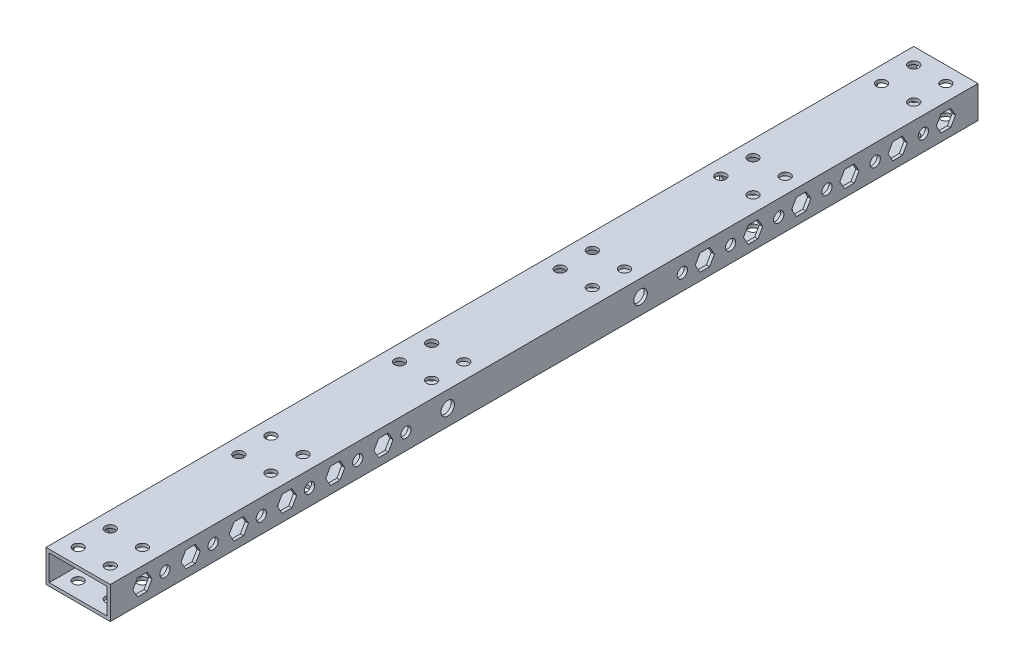
from build123d import *

# Parameters (mm, degrees)
SKETCH_1_W          = 20
SKETCH_1_H          = 10
SKETCH_1_W_2        = 18
SKETCH_1_H_2        = 8
EXTRUDE_1_DEPTH     = 270
SKETCH_2_R          = 1.575
CUT_EXTRUDE_1_DEPTH = 271.924343683
SKETCH_3_R          = 2.1
SKETCH_3_R_2        = 1.6
CUT_EXTRUDE_2_DEPTH = 271.924343683


with BuildPart() as part:
    # 草图1 → 拉伸-薄壁1 (new body)
    with BuildSketch(Plane.XY):
        with Locations((10, -5)):
            Rectangle(SKETCH_1_W, SKETCH_1_H)
        with Locations((10, -5)):
            Rectangle(SKETCH_1_W_2, SKETCH_1_H_2, mode=Mode.SUBTRACT)
    extrude(amount=EXTRUDE_1_DEPTH)

    # 草图2 → 切除-拉伸1 (cut, through all)
    with BuildSketch(Plane(origin=(0, 0, 0), x_dir=(1, 0, 0), z_dir=(0, 1, 0))):
        with Locations(Location((5, -5, 0), (0, 0, 270))):
            Circle(SKETCH_2_R)
        with Locations(Location((15, -5, 0), (0, 0, 90))):
            Circle(SKETCH_2_R)
        with Locations(Location((15, -15, 0), (0, 0, 270))):
            Circle(SKETCH_2_R)
        with Locations(Location((5, -15, 0), (0, 0, 90))):
            Circle(SKETCH_2_R)
        with Locations(Location((5, -255, 0), (0, 0, 270))):
            Circle(SKETCH_2_R)
        with Locations(Location((15, -255, 0), (0, 0, 90))):
            Circle(SKETCH_2_R)
        with Locations(Location((15, -265, 0), (0, 0, 270))):
            Circle(SKETCH_2_R)
        with Locations(Location((5, -265, 0), (0, 0, 90))):
            Circle(SKETCH_2_R)
        with Locations(Location((5, -55, 0), (0, 0, 270))):
            Circle(SKETCH_2_R)
        with Locations(Location((15, -55, 0), (0, 0, 90))):
            Circle(SKETCH_2_R)
        with Locations(Location((5, -65, 0), (0, 0, 90))):
            Circle(SKETCH_2_R)
        with Locations(Location((15, -65, 0), (0, 0, 270))):
            Circle(SKETCH_2_R)
        with Locations(Location((5, -105, 0), (0, 0, 270))):
            Circle(SKETCH_2_R)
        with Locations(Location((15, -105, 0), (0, 0, 90))):
            Circle(SKETCH_2_R)
        with Locations(Location((5, -115, 0), (0, 0, 90))):
            Circle(SKETCH_2_R)
        with Locations(Location((15, -115, 0), (0, 0, 270))):
            Circle(SKETCH_2_R)
        with Locations(Location((15, -155, 0), (0, 0, 90))):
            Circle(SKETCH_2_R)
        with Locations(Location((5, -155, 0), (0, 0, 270))):
            Circle(SKETCH_2_R)
        with Locations(Location((15, -165, 0), (0, 0, 270))):
            Circle(SKETCH_2_R)
        with Locations(Location((5, -165, 0), (0, 0, 90))):
            Circle(SKETCH_2_R)
        with Locations(Location((15, -205, 0), (0, 0, 90))):
            Circle(SKETCH_2_R)
        with Locations(Location((5, -205, 0), (0, 0, 270))):
            Circle(SKETCH_2_R)
        with Locations(Location((15, -215, 0), (0, 0, 270))):
            Circle(SKETCH_2_R)
        with Locations(Location((5, -215, 0), (0, 0, 90))):
            Circle(SKETCH_2_R)
    extrude(amount=-CUT_EXTRUDE_1_DEPTH, mode=Mode.SUBTRACT)

    # 草图3 → 切除-拉伸2 (cut, through all)
    with BuildSketch(Plane.ZY):
        with Locations((105, -5)):
            Circle(SKETCH_3_R)
        with Locations(Location((165, -5, 0), (0, 0, 270))):
            Circle(SKETCH_3_R)
        with Locations(Location((17, -5, 0), (0, 0, 270))):
            Circle(SKETCH_3_R_2)
        with Locations(Location((32, -5, 0), (0, 0, 270))):
            Circle(SKETCH_3_R_2)
        with Locations(Location((47, -5, 0), (0, 0, 270))):
            Circle(SKETCH_3_R_2)
        with Locations(Location((62, -5, 0), (0, 0, 270))):
            Circle(SKETCH_3_R_2)
        with Locations(Location((77, -5, 0), (0, 0, 270))):
            Circle(SKETCH_3_R_2)
        with Locations(Location((92, -5, 0), (0, 0, 270))):
            Circle(SKETCH_3_R_2)
        with Locations((178, -5)):
            Circle(SKETCH_3_R_2)
        with Locations((193, -5)):
            Circle(SKETCH_3_R_2)
        with Locations((208, -5)):
            Circle(SKETCH_3_R_2)
        with Locations((223, -5)):
            Circle(SKETCH_3_R_2)
        with Locations((238, -5)):
            Circle(SKETCH_3_R_2)
        with Locations((253, -5)):
            Circle(SKETCH_3_R_2)
        Polygon((8.5, -7.598076211), (11.5, -7.598076211), (13, -5), (11.5, -2.401923789), (8.5, -2.401923789), (7, -5), align=None)
        Polygon((26.5, -2.401923789), (23.5, -2.401923789), (22, -5), (23.5, -7.598076211), (26.5, -7.598076211), (28, -5), align=None)
        Polygon((41.5, -2.401923789), (38.5, -2.401923789), (37, -5), (38.5, -7.598076211), (41.5, -7.598076211), (43, -5), align=None)
        Polygon((56.5, -2.401923789), (53.5, -2.401923789), (52, -5), (53.5, -7.598076211), (56.5, -7.598076211), (58, -5), align=None)
        Polygon((71.5, -2.401923789), (68.5, -2.401923789), (67, -5), (68.5, -7.598076211), (71.5, -7.598076211), (73, -5), align=None)
        Polygon((86.5, -2.401923789), (83.5, -2.401923789), (82, -5), (83.5, -7.598076211), (86.5, -7.598076211), (88, -5), align=None)
        Polygon((186.5, -2.401923789), (188, -5), (186.5, -7.598076211), (183.5, -7.598076211), (182, -5), (183.5, -2.401923789), align=None)
        Polygon((201.5, -2.401923789), (203, -5), (201.5, -7.598076211), (198.5, -7.598076211), (197, -5), (198.5, -2.401923789), align=None)
        Polygon((216.5, -2.401923789), (218, -5), (216.5, -7.598076211), (213.5, -7.598076211), (212, -5), (213.5, -2.401923789), align=None)
        Polygon((231.5, -2.401923789), (233, -5), (231.5, -7.598076211), (228.5, -7.598076211), (227, -5), (228.5, -2.401923789), align=None)
        Polygon((246.5, -2.401923789), (248, -5), (246.5, -7.598076211), (243.5, -7.598076211), (242, -5), (243.5, -2.401923789), align=None)
        Polygon((263, -5), (261.5, -7.598076211), (258.5, -7.598076211), (257, -5), (258.5, -2.401923789), (261.5, -2.401923789), align=None)
    extrude(amount=-CUT_EXTRUDE_2_DEPTH, mode=Mode.SUBTRACT)


solid = part.part
